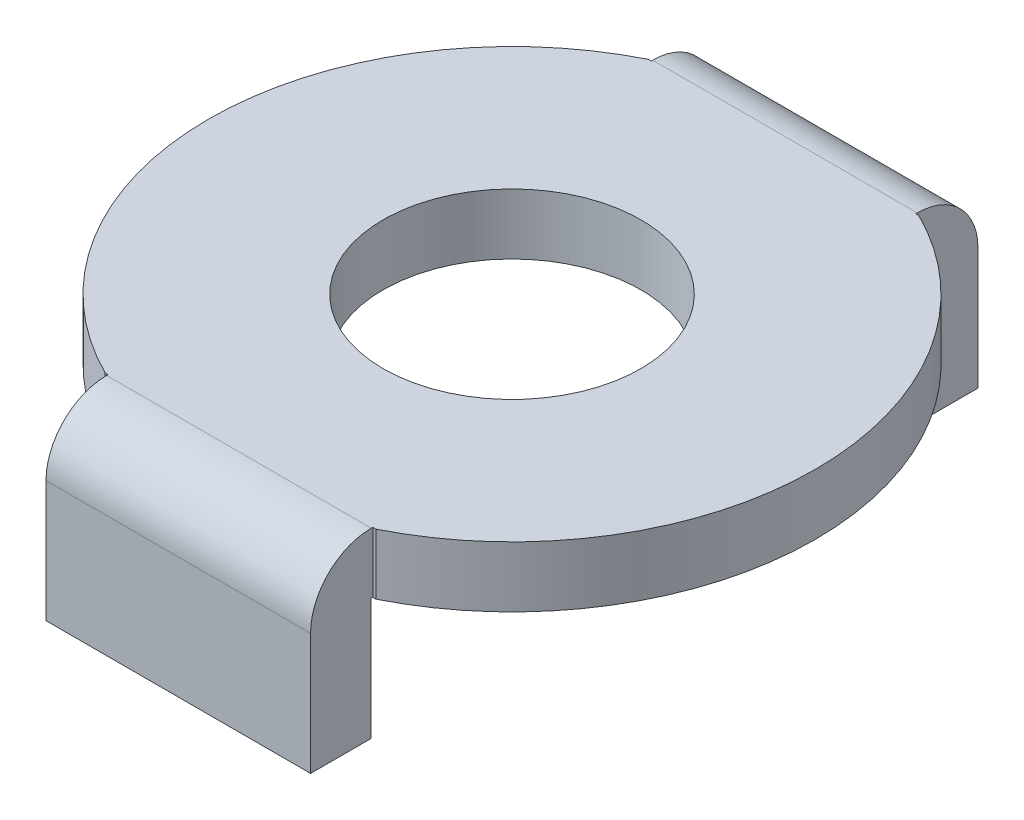
from build123d import *

# Parameters (mm, degrees)
EXTRUDE_1_DEPTH      = 4.360333
EXTRUDE_1_DEPTH_BACK = 4.360333
EXTRUDE_2_DEPTH      = 2
SKETCH_3_R           = 4.25
CUT_EXTRUDE_1_DEPTH  = 2


with BuildPart() as part:
    # 草图1 → 凸台-拉伸1 (new, two sides: drawn at the far end of the back side and taken through both)
    with BuildSketch(Plane(origin=(0, 0, 0), x_dir=(0, 0, -1), z_dir=(1, 0, 0)).offset(-EXTRUDE_1_DEPTH_BACK)):
        with BuildLine():
            Line((-11, 0), (-11, -4))
            Line((-11, -4), (-9, -4))
            Line((-9, -4), (-9, 0))
            Line((-9, 0), (9, 0))
            Line((9, 0), (9, -4))
            Line((9, -4), (11, -4))
            Line((11, -4), (11, 0))
            ThreePointArc((11, 0), (10.414213562, 1.414213562), (9, 2))
            Line((9, 2), (-9, 2))
            ThreePointArc((-9, 2), (-10.414213562, 1.414213562), (-11, 0))
        make_face()
    extrude(amount=EXTRUDE_1_DEPTH + EXTRUDE_1_DEPTH_BACK)

    # 草图2 → 凸台-拉伸2 (add)
    with BuildSketch(Plane(origin=(0, 0, 0), x_dir=(1, 0, 0), z_dir=(0, 1, 0))):
        with BuildLine():
            Line((-4.460661386, -8.95), (4.460661386, -8.95))
            ThreePointArc((4.460661386, -8.95), (10, 0), (4.460661386, 8.95))
            Line((4.460661386, 8.95), (-4.460661386, 8.95))
            ThreePointArc((-4.460661386, 8.95), (-10, 0), (-4.460661386, -8.95))
        make_face()
    extrude(amount=EXTRUDE_2_DEPTH)

    # 草图3 → 切除-拉伸1 (cut)
    with BuildSketch(Plane(origin=(0, 0, 0), x_dir=(1, 0, 0), z_dir=(0, 1, 0))):
        Circle(SKETCH_3_R)
    extrude(amount=CUT_EXTRUDE_1_DEPTH, mode=Mode.SUBTRACT)


solid = part.part
